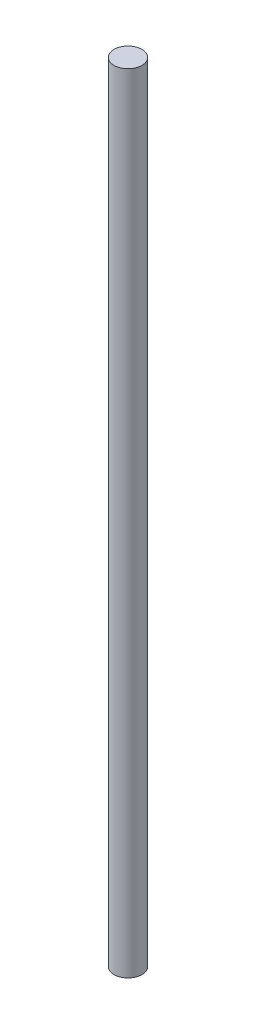
from build123d import *

# Parameters (mm, degrees)
SKETCH1_R           = 12.5
BOSS_EXTRUDE1_DEPTH = 706.744000022


with BuildPart() as part:
    # Sketch1 → Boss-Extrude1 (new body)
    with BuildSketch(Plane(origin=(0, 0, 0), x_dir=(1, 0, 0), z_dir=(0, 1, 0))):
        with Locations(Location((0, 0, 0), (0, 0, 270))):
            Circle(SKETCH1_R)
    extrude(amount=BOSS_EXTRUDE1_DEPTH)


solid = part.part
